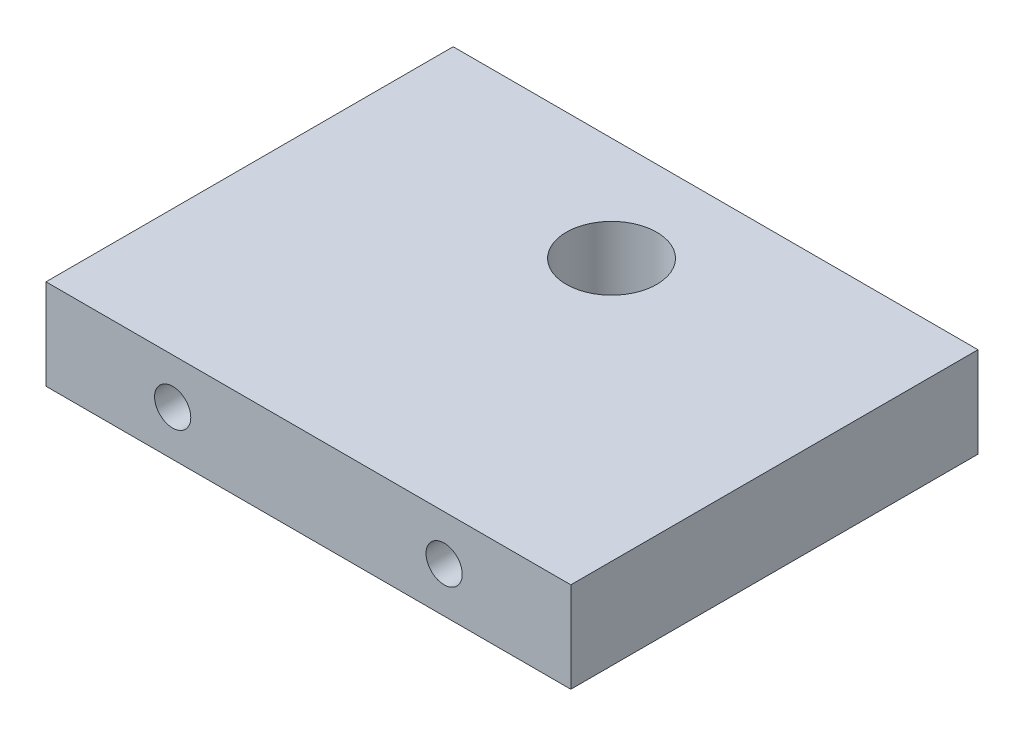
from build123d import *

# Parameters (mm, degrees)
SKETCH1_W           = 58
SKETCH1_H           = 10
SKETCH1_R           = 2
BOSS_EXTRUDE1_DEPTH = 55
SKETCH3_W           = 58
SKETCH3_H           = 10
CUT_EXTRUDE3_DEPTH  = 10
SKETCH4_R           = 5
CUT_EXTRUDE4_DEPTH  = 10


with BuildPart() as part:
    # Sketch1 → Boss-Extrude1 (new body)
    with BuildSketch(Plane.XY):
        with Locations((29, -5)):
            Rectangle(SKETCH1_W, SKETCH1_H)
        with Locations((14, -5)):
            Circle(SKETCH1_R, mode=Mode.SUBTRACT)
        with Locations((44, -5)):
            Circle(SKETCH1_R, mode=Mode.SUBTRACT)
    extrude(amount=BOSS_EXTRUDE1_DEPTH)

    # Sketch3 → Cut-Extrude3 (cut)
    with BuildSketch(Plane(origin=(0, 0, 0), x_dir=(-1, 0, 0), z_dir=(0, 0, -1))):
        with Locations((-29, -5)):
            Rectangle(SKETCH3_W, SKETCH3_H)
    extrude(amount=-CUT_EXTRUDE3_DEPTH, mode=Mode.SUBTRACT)

    # Sketch4 → Cut-Extrude4 (cut)
    with BuildSketch(Plane(origin=(0, 0, 0), x_dir=(1, 0, 0), z_dir=(0, 1, 0))):
        with Locations(Location((29, -21.5, 0), (0, 0, 270))):
            Circle(SKETCH4_R)
    extrude(amount=-CUT_EXTRUDE4_DEPTH, mode=Mode.SUBTRACT)


solid = part.part
